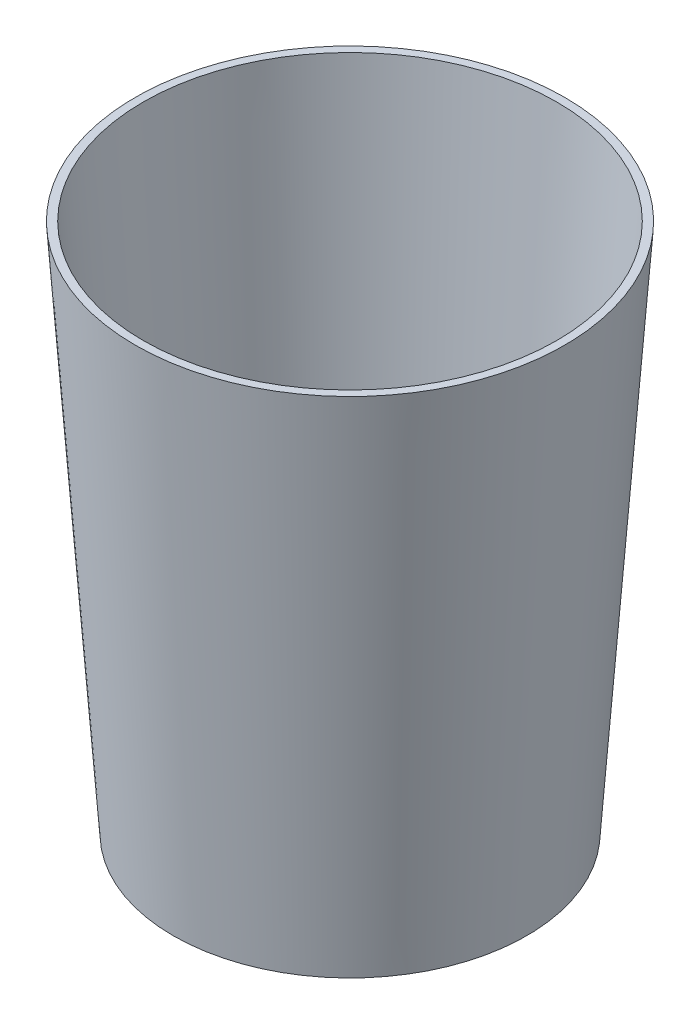
from build123d import *

# Parameters (mm, degrees)
SHELL1_T = -4


with BuildPart() as part:
    # Sketch7 → Revolve1 (revolve)
    with BuildSketch(Plane.XY, mode=Mode.PRIVATE) as revolve1_sk:
        Polygon((0, 0), (0, 266.7), (107.95, 266.7), (88.9, 0), align=None)
    revolve(revolve1_sk.sketch.rotate(Axis((0, 0, 0), (0, 1, 0)), 90), axis=Axis((0, 0, 0), (0, 1, 0)))

    # Shell1
    shell1_openings = [part.faces().sort_by_distance(p)[0] for p in [
        (0, 266.7, 0),
    ]]
    offset(amount=SHELL1_T, openings=shell1_openings, kind=Kind.INTERSECTION)


solid = part.part
